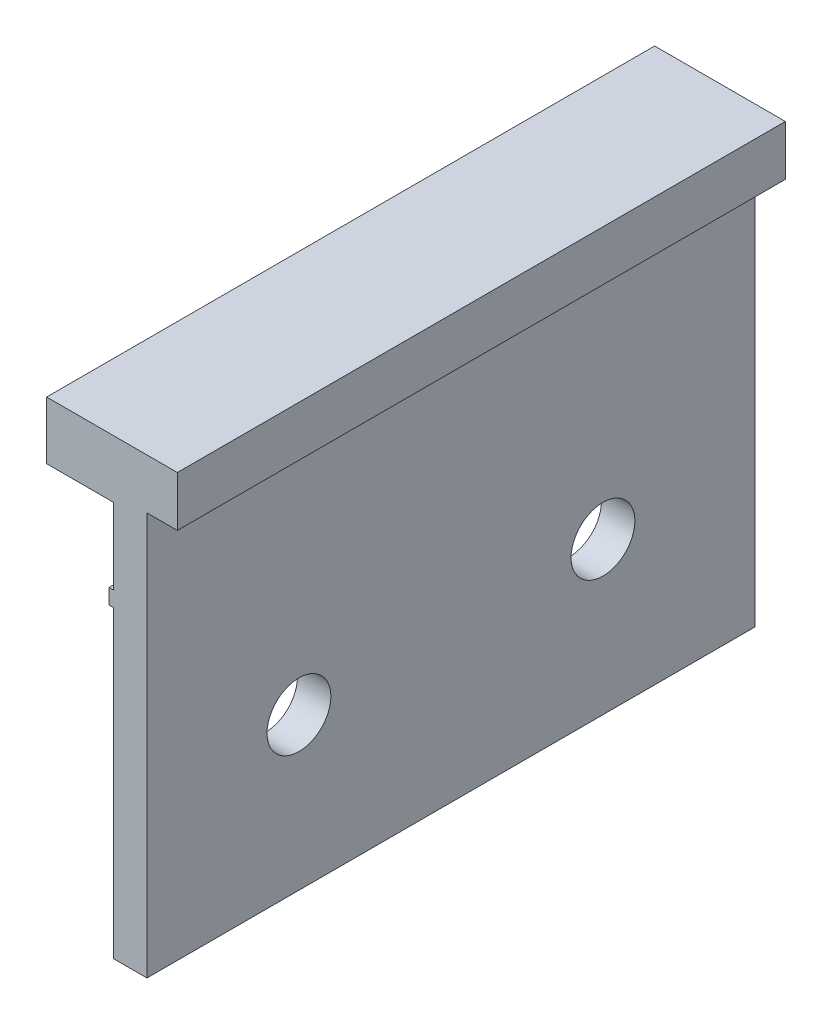
from build123d import *

# Parameters (mm, degrees)
CLIP_EXTRUDE_START           = -20
CLIP_EXTRUDE_DEPTH           = 40
ANTIOFFSETBUMP_EXTRUDE_START = -20
ANTIUPLIFTBUMP_SKETCH_W      = 0.3
ANTIUPLIFTBUMP_SKETCH_H      = 1
ANTIOFFSETBUMP_EXTRUDE_DEPTH = 40
MOUNTHOLES_CUT_DEPTH         = 55.665894029
MOUNTHOLES_CUT_DEPTH_BACK    = 55.665894029
MOUNTHOLES_SKETCH_R          = 2.1


with BuildPart() as part:
    # panelClipSection_sketch → clip_extrude (new body)
    with BuildSketch(Plane.XY.offset(CLIP_EXTRUDE_START)):
        Polygon((-9.40000037, -23.99999963), (-5.00000037, -23.99999963), (-5.00000037, -49.99999963), (-2.80000037, -49.99999963), (-2.80000037, -23.49999963), (-0.80000037, -23.49999963), (-0.80000037, -20.19999963), (-9.40000037, -20.19999963), align=None)
    extrude(amount=CLIP_EXTRUDE_DEPTH)

    # antiUpliftBump_sketch → antiOffsetBump_extrude (add)
    with BuildSketch(Plane.XY.offset(ANTIOFFSETBUMP_EXTRUDE_START)):
        with Locations((-5.15000037, -29.49999963)):
            Rectangle(ANTIUPLIFTBUMP_SKETCH_W, ANTIUPLIFTBUMP_SKETCH_H)
    extrude(amount=ANTIOFFSETBUMP_EXTRUDE_DEPTH)

    # mountHoles_sketch → mountHoles_cut (cut, two sides: drawn at the far end of the back side and taken through both)
    with BuildSketch(Plane(origin=(0, 0, 0), x_dir=(0, 0, -1), z_dir=(1, 0, 0)).offset(-MOUNTHOLES_CUT_DEPTH_BACK)):
        with Locations((10, -39.99999963)):
            Circle(MOUNTHOLES_SKETCH_R)
        with Locations((-10, -39.99999963)):
            Circle(MOUNTHOLES_SKETCH_R)
    extrude(amount=MOUNTHOLES_CUT_DEPTH + MOUNTHOLES_CUT_DEPTH_BACK, mode=Mode.SUBTRACT)


solid = part.part
